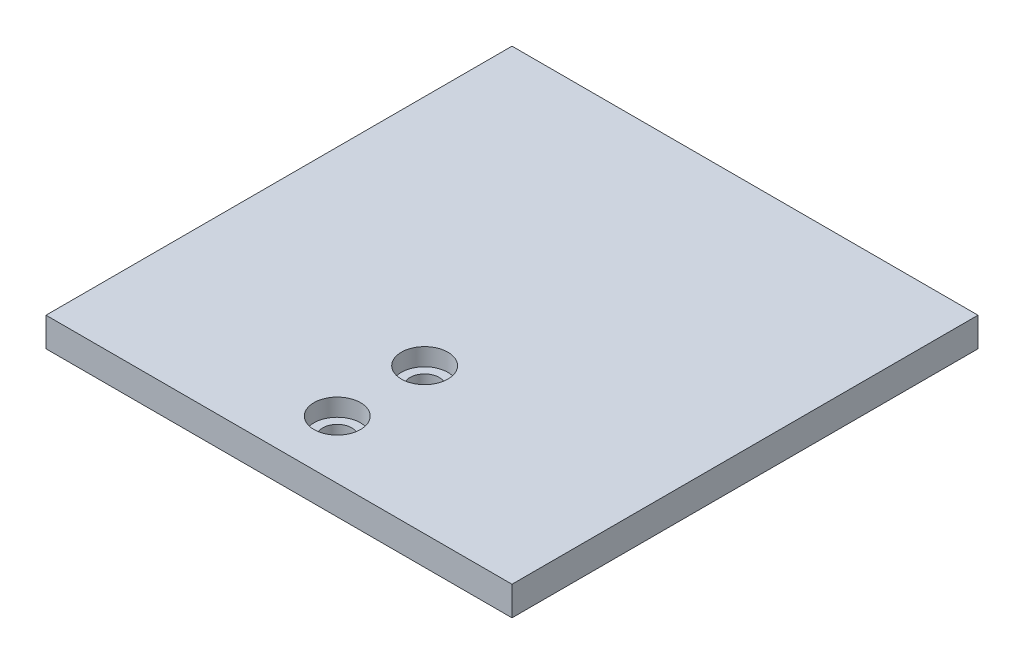
from build123d import *

# Parameters (mm, degrees)
SKETCH1_W           = 80
SKETCH1_H           = 80
BOSS_EXTRUDE1_DEPTH = 5
SKETCH2_R           = 2.5
CUT_EXTRUDE1_DEPTH  = 15
SKETCH3_R           = 4
CUT_EXTRUDE2_DEPTH  = 3


with BuildPart() as part:
    # Sketch1 → Boss-Extrude1 (new body)
    with BuildSketch(Plane(origin=(0, 0, 0), x_dir=(1, 0, 0), z_dir=(0, 1, 0))):
        Rectangle(SKETCH1_W, SKETCH1_H)
    extrude(amount=BOSS_EXTRUDE1_DEPTH)

    # Sketch2 → Cut-Extrude1 (cut)
    with BuildSketch(Plane(origin=(0, 5, 0), x_dir=(1, 0, 0), z_dir=(0, 1, 0))):
        with Locations(Location((0, -15, 0), (0, 0, 270))):
            Circle(SKETCH2_R)
        with Locations(Location((0, -30, 0), (0, 0, 270))):
            Circle(SKETCH2_R)
    extrude(amount=-CUT_EXTRUDE1_DEPTH, mode=Mode.SUBTRACT)

    # Sketch3 → Cut-Extrude2 (cut)
    with BuildSketch(Plane(origin=(0, 5, 0), x_dir=(1, 0, 0), z_dir=(0, 1, 0))):
        with Locations(Location((0, -15, 0), (0, 0, 270))):
            Circle(SKETCH3_R)
        with Locations(Location((0, -30, 0), (0, 0, 270))):
            Circle(SKETCH3_R)
    extrude(amount=-CUT_EXTRUDE2_DEPTH, mode=Mode.SUBTRACT)


solid = part.part
